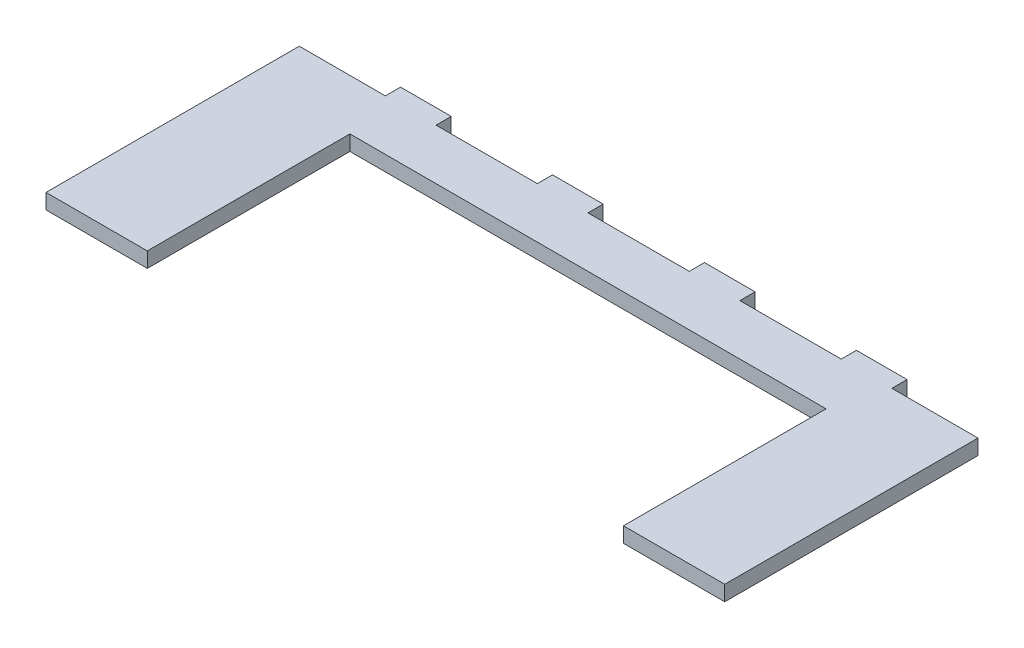
from build123d import *

# Parameters (mm, degrees)
SKETCH1_W           = 134
SKETCH1_H           = 50
BOSS_EXTRUDE1_DEPTH = 3
SKETCH2_W           = 94
SKETCH2_H           = 40
CUT_EXTRUDE1_DEPTH  = 13
SKETCH3_W           = 10
SKETCH3_H           = 3
BOSS_EXTRUDE2_DEPTH = 3


with BuildPart() as part:
    # Sketch1 → Boss-Extrude1 (new body)
    with BuildSketch(Plane(origin=(0, 0, 0), x_dir=(1, 0, 0), z_dir=(0, 1, 0))):
        Rectangle(SKETCH1_W, SKETCH1_H)
    extrude(amount=BOSS_EXTRUDE1_DEPTH)

    # Sketch2 → Cut-Extrude1 (cut)
    with BuildSketch(Plane(origin=(0, 3, 0), x_dir=(1, 0, 0), z_dir=(0, 1, 0))):
        with Locations((0, -5)):
            Rectangle(SKETCH2_W, SKETCH2_H)
    extrude(amount=-CUT_EXTRUDE1_DEPTH, mode=Mode.SUBTRACT)

    # Sketch3 → Boss-Extrude2 (add)
    with BuildSketch(Plane(origin=(0, 0, -25), x_dir=(-1, 0, 0), z_dir=(0, 0, -1))):
        with Locations((-45, 1.5)):
            Rectangle(SKETCH3_W, SKETCH3_H)
        with Locations((-15, 1.5)):
            Rectangle(SKETCH3_W, SKETCH3_H)
        with Locations((15, 1.5)):
            Rectangle(SKETCH3_W, SKETCH3_H)
        with Locations((45, 1.5)):
            Rectangle(SKETCH3_W, SKETCH3_H)
    extrude(amount=BOSS_EXTRUDE2_DEPTH)


solid = part.part
